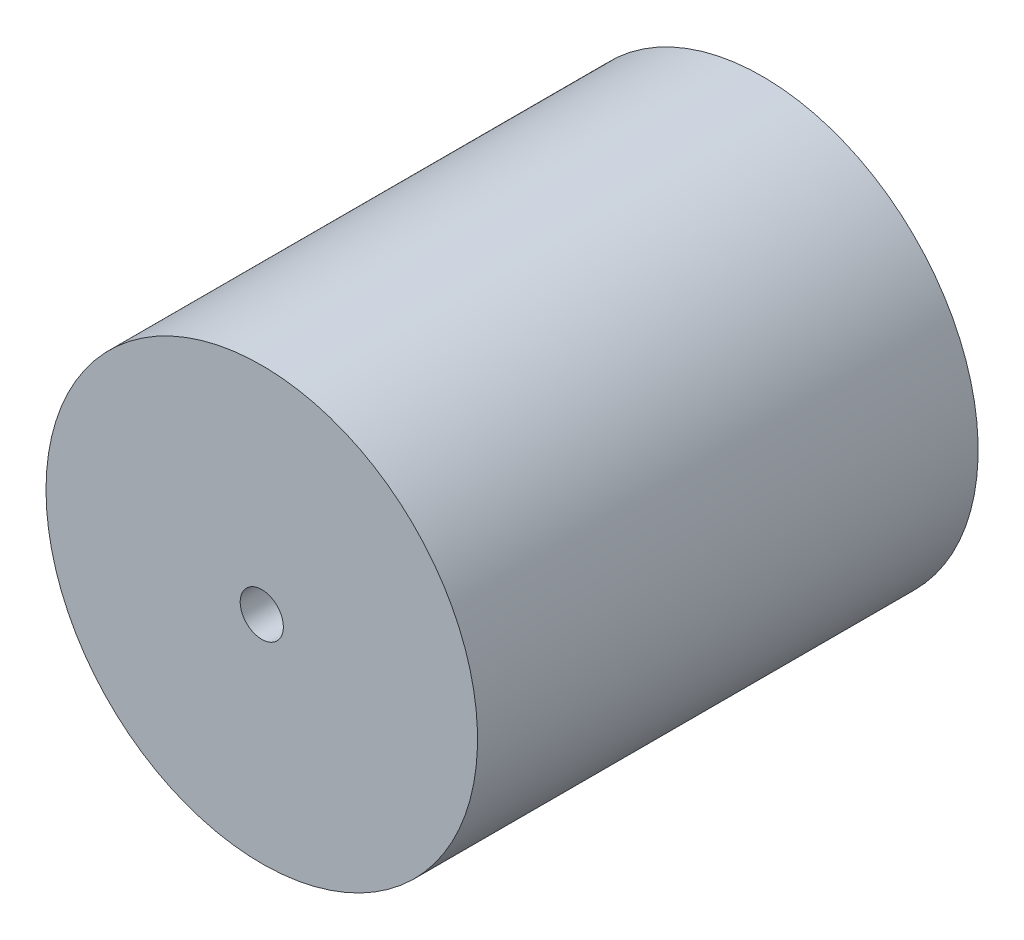
from build123d import *

# Parameters (mm, degrees)
SKETCH1_R                 = 12.5
BOSS_EXTRUDE1_DEPTH       = 29
M3X0_5_TAPPED_HOLE1_D     = 2.5
M3X0_5_TAPPED_HOLE1_DEPTH = 20
M3X0_5_TAPPED_HOLE1_TIP   = 0.751075774


with BuildPart() as part:
    # Sketch1 → Boss-Extrude1 (new body)
    with BuildSketch(Plane.XY):
        with Locations(Location((0, 0, 0), (0, 0, 180))):
            Circle(SKETCH1_R)
    extrude(amount=BOSS_EXTRUDE1_DEPTH)

    # M3x0.5 Tapped Hole1
    with Locations(Plane.XY.offset(29)):
        with Locations((0, 0)):
            Hole(M3X0_5_TAPPED_HOLE1_D / 2, depth=M3X0_5_TAPPED_HOLE1_DEPTH)
            with Locations((0, 0, -(M3X0_5_TAPPED_HOLE1_DEPTH + M3X0_5_TAPPED_HOLE1_TIP / 2))):  # 118° drill point
                Cone(0, M3X0_5_TAPPED_HOLE1_D / 2, M3X0_5_TAPPED_HOLE1_TIP, mode=Mode.SUBTRACT)


solid = part.part
